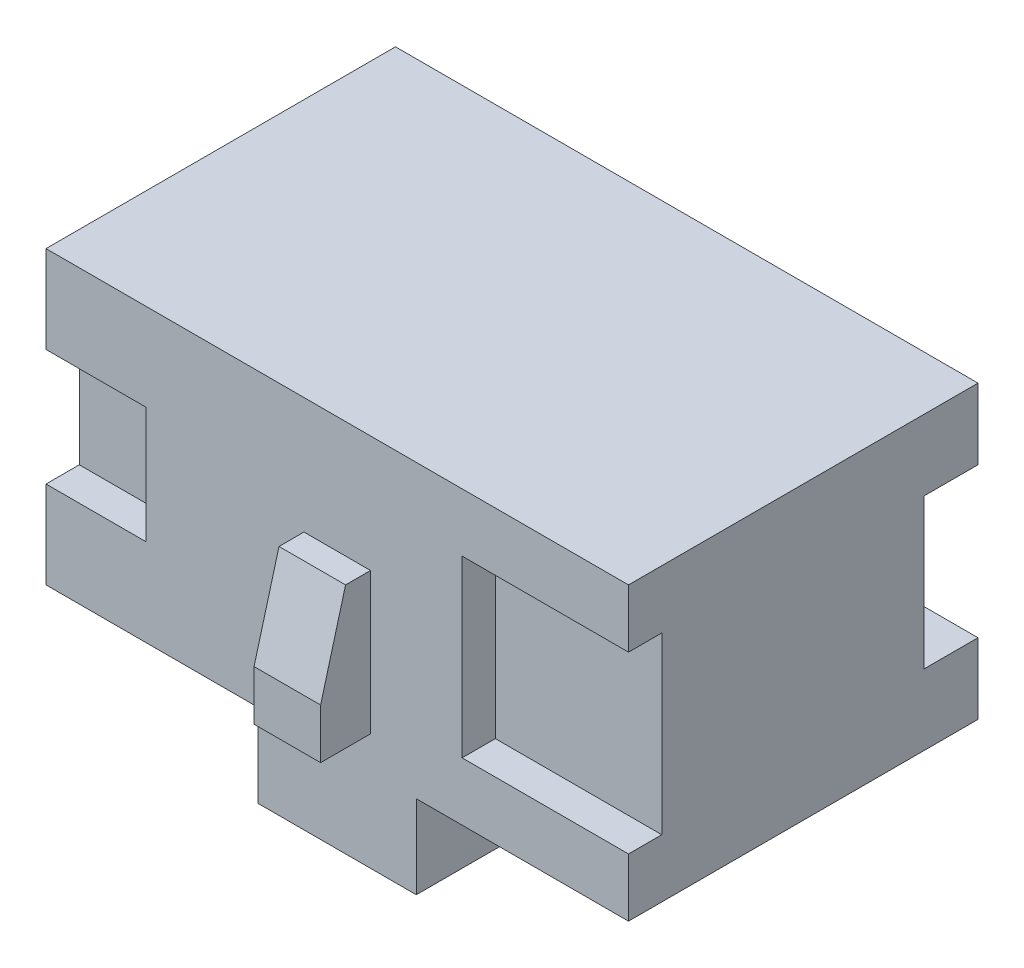
from build123d import *

# Parameters (mm, degrees)
SKETCH_1_W           = 19
SKETCH_1_H           = 10
SKETCH_1_W_2         = 70
SKETCH_1_H_2         = 35
EXTRUDE_1_DEPTH      = 42
SKETCH_2_W           = 6.5
SKETCH_2_H           = 18
CUT_EXTRUDE_1_DEPTH  = 87.140872993
SKETCH_3_W           = 20
SKETCH_3_H           = 21
SKETCH_3_W_2         = 12
SKETCH_3_H_2         = 14
CUT_EXTRUDE_2_DEPTH  = 4
EXTRUDE_2_DEPTH      = 4
EXTRUDE_2_DEPTH_BACK = 4


with BuildPart() as part:
    # Эскиз1 → Бобышка-Вытянуть1 (new body)
    with BuildSketch(Plane.XY):
        with Locations((0, -22.5)):
            Rectangle(SKETCH_1_W, SKETCH_1_H)
        Rectangle(SKETCH_1_W_2, SKETCH_1_H_2)
    extrude(amount=EXTRUDE_1_DEPTH)

    # Эскиз2 → Вырез-Вытянуть1 (cut, through all)
    with BuildSketch(Plane(origin=(35, 0, 0), x_dir=(0, 0, -1), z_dir=(1, 0, 0))):
        with Locations((-3.25, 0)):
            Rectangle(SKETCH_2_W, SKETCH_2_H)
    extrude(amount=-CUT_EXTRUDE_1_DEPTH, mode=Mode.SUBTRACT)

    # Эскиз3 → Вырез-Вытянуть2 (cut)
    with BuildSketch(Plane.XY.offset(42)):
        with Locations((25, 0)):
            Rectangle(SKETCH_3_W, SKETCH_3_H)
        with Locations((-29, 0)):
            Rectangle(SKETCH_3_W_2, SKETCH_3_H_2)
    extrude(amount=-CUT_EXTRUDE_2_DEPTH, mode=Mode.SUBTRACT)

    # Эскиз4 → Бобышка-Вытянуть2 (add, two sides: drawn at the far end of the back side and taken through both)
    with BuildSketch(Plane(origin=(0, 0, 0), x_dir=(0, 0, -1), z_dir=(1, 0, 0)).offset(-EXTRUDE_2_DEPTH_BACK)):
        Polygon((-48, -13.5), (-42, -13.5), (-42, 3.5), (-45, 3.5), (-48, -7.5), align=None)
    extrude(amount=EXTRUDE_2_DEPTH + EXTRUDE_2_DEPTH_BACK)


solid = part.part
